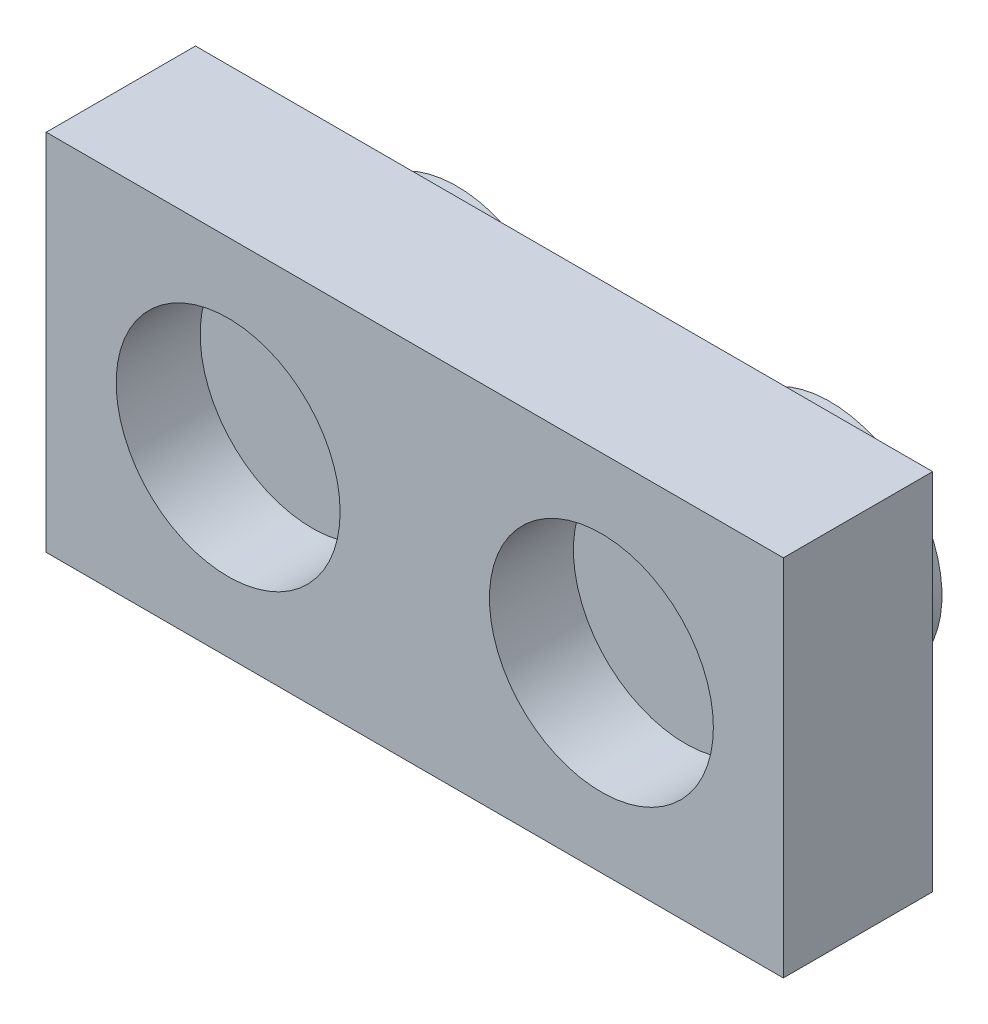
from build123d import *

# Parameters (mm, degrees)
SKETCH_3_W          = 15.8
SKETCH_3_H          = 7.8
EXTRUDE_2_DEPTH     = 3.2
SKETCH_4_R          = 2.4
EXTRUDE_3_DEPTH     = 1.7
SKETCH_5_R          = 2.4
CUT_EXTRUDE_1_DEPTH = 1.8


with BuildPart() as part:
    # Эскиз3 → Бобышка-Вытянуть2 (new body)
    with BuildSketch(Plane.XY):
        Rectangle(SKETCH_3_W, SKETCH_3_H)
    extrude(amount=EXTRUDE_2_DEPTH)

    # Эскиз4 → Бобышка-Вытянуть3 (add)
    with BuildSketch(Plane(origin=(0, 0, 0), x_dir=(-1, 0, 0), z_dir=(0, 0, -1))):
        with Locations((-4, 0)):
            Circle(SKETCH_4_R)
        with Locations((4, 0)):
            Circle(SKETCH_4_R)
    extrude(amount=EXTRUDE_3_DEPTH)

    # Эскиз5 → Вырез-Вытянуть1 (cut)
    with BuildSketch(Plane.XY.offset(3.2)):
        with Locations(Location((-4, 0, 0), (0, 0, 180))):
            Circle(SKETCH_5_R)
        with Locations(Location((4, 0, 0), (0, 0, 180))):
            Circle(SKETCH_5_R)
    extrude(amount=-CUT_EXTRUDE_1_DEPTH, mode=Mode.SUBTRACT)


solid = part.part
